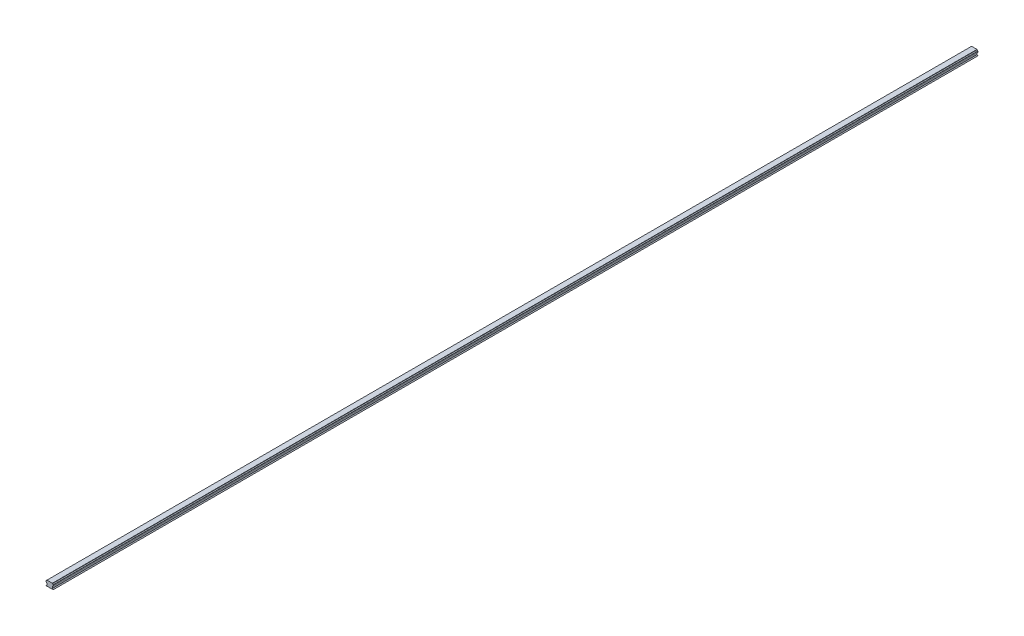
from build123d import *

# Parameters (mm, degrees)
ESTRUSIONE_ESTRUSIONE1_DEPTH = 2900


with BuildPart() as part:
    # Schizzo1 → Estrusione-Estrusione1 (new body)
    with BuildSketch(Plane.XY):
        with BuildLine():
            ThreePointArc((12.304198043, -5.970812526), (10.731021445, -6.695460987), (10.006372984, -8.268637585))
            Line((10.006372984, -8.268637585), (9.498788398, -8.776222172))
            Line((9.498788398, -8.776222172), (9.498788398, -13.776222172))
            Line((9.498788398, -13.776222172), (11.998788398, -16.276222172))
            Line((11.998788398, -16.276222172), (-10.001211602, -16.276222172))
            Line((-10.001211602, -16.276222172), (-7.501211602, -13.776222172))
            Line((-7.501211602, -13.776222172), (-7.501211602, -8.776222172))
            Line((-7.501211602, -8.776222172), (-8.008796188, -8.268637585))
            ThreePointArc((-8.008796188, -8.268637585), (-8.733444649, -6.695460987), (-10.306621247, -5.970812526))
            Line((-10.306621247, -5.970812526), (-10.501211602, -5.776222172))
            Line((-10.501211602, -5.776222172), (-10.501211602, -2.776222172))
            Line((-10.501211602, -2.776222172), (-10.306621247, -2.581631817))
            ThreePointArc((-10.306621247, -2.581631817), (-8.733444649, -1.856983356), (-8.008796188, -0.283806758))
            Line((-8.008796188, -0.283806758), (-7.501211602, 0.223777828))
            Line((-7.501211602, 0.223777828), (9.498788398, 0.223777828))
            Line((9.498788398, 0.223777828), (10.006372984, -0.283806758))
            ThreePointArc((10.006372984, -0.283806758), (10.731021445, -1.856983356), (12.304198043, -2.581631817))
            Line((12.304198043, -2.581631817), (12.498788398, -2.776222172))
            Line((12.498788398, -2.776222172), (12.498788398, -5.776222172))
            Line((12.498788398, -5.776222172), (12.304198043, -5.970812526))
        make_face()
    extrude(amount=ESTRUSIONE_ESTRUSIONE1_DEPTH)


solid = part.part
